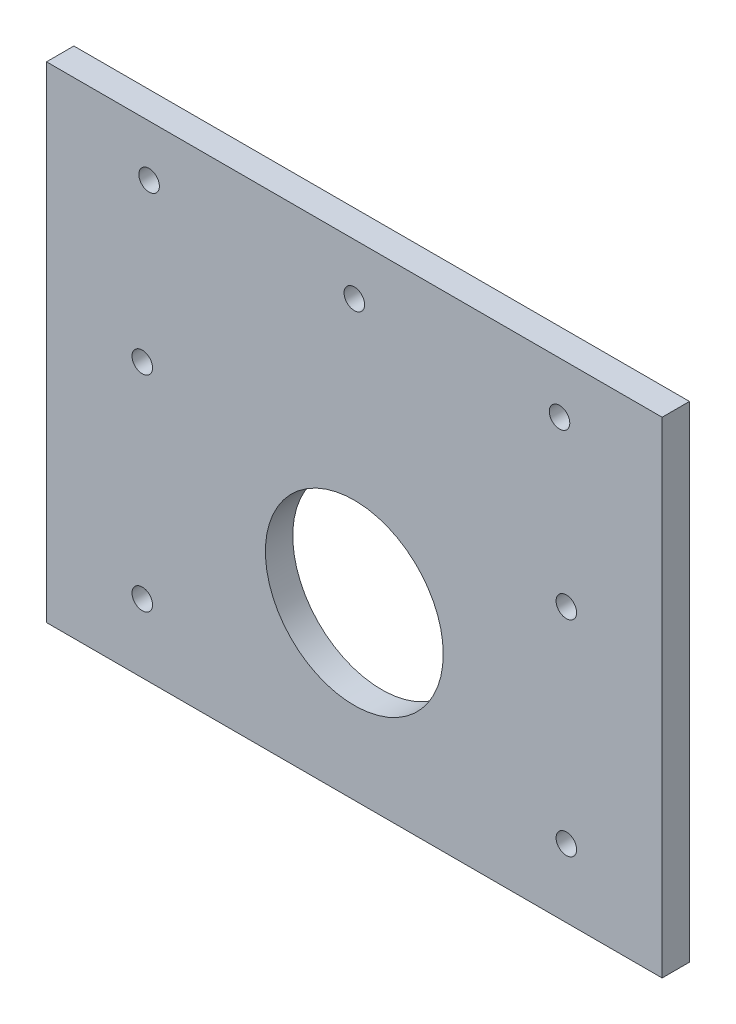
from build123d import *

# Parameters (mm, degrees)
SKETCH_1_W          = 90
SKETCH_1_H          = 71
EXTRUDE_1_DEPTH     = 4
SKETCH_2_R          = 1.5
CUT_EXTRUDE_1_DEPTH = 58.456505289
SKETCH_3_R          = 13
SKETCH_3_R_2        = 1.5
CUT_EXTRUDE_2_DEPTH = 58.456505289


with BuildPart() as part:
    # 草图1 → 凸台-拉伸1 (new body)
    with BuildSketch(Plane.XY):
        Rectangle(SKETCH_1_W, SKETCH_1_H)
    extrude(amount=EXTRUDE_1_DEPTH)

    # 草图2 → 切除-拉伸1 (cut, through all)
    with BuildSketch(Plane.XY.offset(4)):
        with Locations((0, 28)):
            Circle(SKETCH_2_R)
        with Locations((-30, 28)):
            Circle(SKETCH_2_R)
        with Locations(Location((30, 28, 0), (0, 0, 180))):
            Circle(SKETCH_2_R)
    extrude(amount=-CUT_EXTRUDE_1_DEPTH, mode=Mode.SUBTRACT)

    # 草图3 → 切除-拉伸2 (cut, through all)
    with BuildSketch(Plane.XY.offset(4)):
        with Locations((0, -10.5)):
            Circle(SKETCH_3_R)
        with Locations((-31, 4.5)):
            Circle(SKETCH_3_R_2)
        with Locations((-31, -25.5)):
            Circle(SKETCH_3_R_2)
        with Locations((31, -25.5)):
            Circle(SKETCH_3_R_2)
        with Locations((31, 4.5)):
            Circle(SKETCH_3_R_2)
    extrude(amount=-CUT_EXTRUDE_2_DEPTH, mode=Mode.SUBTRACT)


solid = part.part
